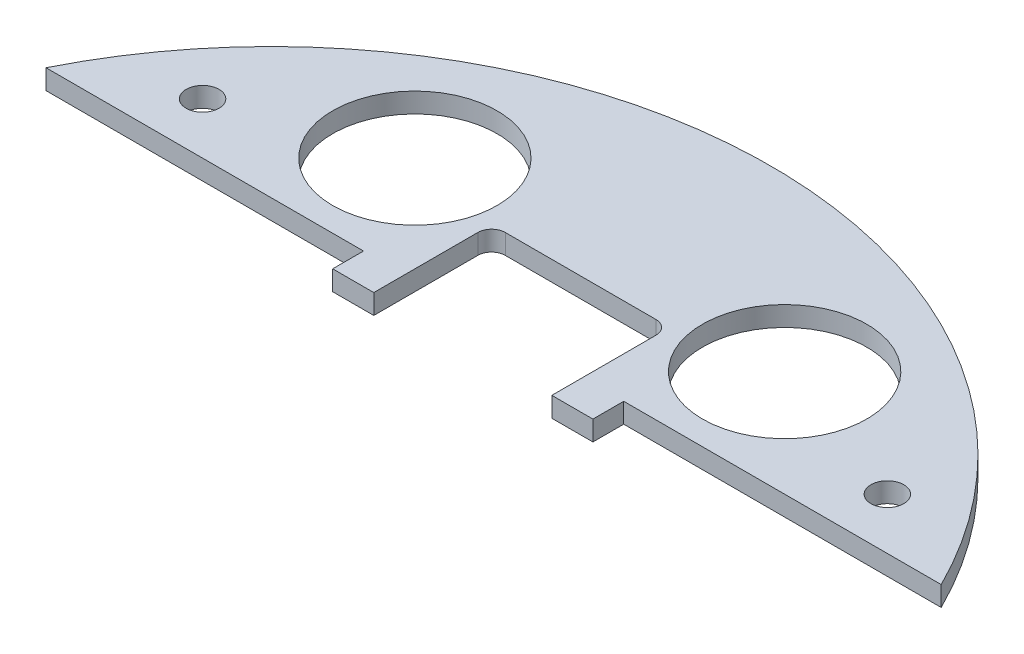
from build123d import *

# Parameters (mm, degrees)
BOSS_EXTRUDE1_DEPTH  = 2.9
SOLENOID_PLACEMENT_W = 38
SOLENOID_PLACEMENT_H = 64
CUT_EXTRUDE1_DEPTH   = 104.278313309
CUT_EXTRUDE4_DEPTH   = 104.278313309
SKETCH5_R            = 12
CUT_EXTRUDE5_DEPTH   = 104.278313309
SKETCH6_R            = 2.4
CUT_EXTRUDE6_DEPTH   = 104.278313309
SKETCH7_W            = 10
SKETCH7_H            = 62.80248699
CUT_EXTRUDE7_DEPTH   = 104.278313309
CUT_EXTRUDE3_DEPTH   = 104.278313309


with BuildPart() as part:
    # Sketch1 → Boss-Extrude1 (new body)
    with BuildSketch(Plane(origin=(0, 0, 0), x_dir=(1, 0, 0), z_dir=(0, 1, 0))):
        with BuildLine():
            ThreePointArc((36.856602833, -63.012624351), (0, 73), (-36.856602833, -63.012624351))
            ThreePointArc((-36.856602833, -63.012624351), (-33.368752207, -63.602994345), (-30.363140064, -61.737536127))
            ThreePointArc((-30.363140064, -61.737536127), (0, -46.75), (30.363140064, -61.737536127))
            ThreePointArc((30.363140064, -61.737536127), (33.368752207, -63.602994345), (36.856602833, -63.012624351))
        make_face()
    extrude(amount=BOSS_EXTRUDE1_DEPTH)

    # solenoid placement → Cut-Extrude1 (cut, through all)
    with BuildSketch(Plane(origin=(0, 2.9, 0), x_dir=(1, 0, 0), z_dir=(0, 1, 0))):
        with Locations((0, -4)):
            Rectangle(SOLENOID_PLACEMENT_W, SOLENOID_PLACEMENT_H)
    extrude(amount=-CUT_EXTRUDE1_DEPTH, mode=Mode.SUBTRACT)

    # Sketch4 → Cut-Extrude4 (cut, through all)
    with BuildSketch(Plane(origin=(0, 2.9, 0), x_dir=(1, 0, 0), z_dir=(0, 1, 0))):
        with BuildLine():
            Line((-13, 28), (13, 28))
            Line((13, 28), (13, 43.2))
            ThreePointArc((13, 43.2), (12.414213562, 44.614213562), (11, 45.2))
            Line((11, 45.2), (-11, 45.2))
            ThreePointArc((-11, 45.2), (-12.414213562, 44.614213562), (-13, 43.2))
            Line((-13, 43.2), (-13, 28))
        make_face()
    extrude(amount=-CUT_EXTRUDE4_DEPTH, mode=Mode.SUBTRACT)

    # Sketch5 → Cut-Extrude5 (cut, through all)
    with BuildSketch(Plane(origin=(0, 2.9, 0), x_dir=(1, 0, 0), z_dir=(0, 1, 0))):
        with Locations(Location((27, 48, 0), (0, 0, 270))):
            Circle(SKETCH5_R)
        with Locations(Location((-27, 48, 0), (0, 0, 270))):
            Circle(SKETCH5_R)
    extrude(amount=-CUT_EXTRUDE5_DEPTH, mode=Mode.SUBTRACT)

    # Sketch6 → Cut-Extrude6 (cut, through all)
    with BuildSketch(Plane(origin=(0, 2.9, 0), x_dir=(1, 0, 0), z_dir=(0, 1, 0))):
        with Locations(Location((40, -40, 0), (0, 0, 270))):
            Circle(SKETCH6_R)
        with Locations(Location((-40, -40, 0), (0, 0, 270))):
            Circle(SKETCH6_R)
        with Locations(Location((-50, 40, 0), (0, 0, 270))):
            Circle(SKETCH6_R)
        with Locations(Location((50, 40, 0), (0, 0, 270))):
            Circle(SKETCH6_R)
    extrude(amount=-CUT_EXTRUDE6_DEPTH, mode=Mode.SUBTRACT)

    # Sketch7 → Cut-Extrude7 (cut, through all)
    with BuildSketch(Plane(origin=(0, 2.9, 0), x_dir=(1, 0, 0), z_dir=(0, 1, 0))):
        with Locations((0, -31.401243495)):
            Rectangle(SKETCH7_W, SKETCH7_H)
    extrude(amount=-CUT_EXTRUDE7_DEPTH, mode=Mode.SUBTRACT)

    # Sketch3 → Cut-Extrude3 (cut, through all)
    with BuildSketch(Plane(origin=(0, 2.9, 0), x_dir=(1, 0, 0), z_dir=(0, 1, 0))):
        Polygon((-19, 28), (19, 28), (19, 32.5), (73, 32.5), (73, -32.5), (-73, -32.5), (-73, 32.5), (-19, 32.5), align=None)
    extrude(amount=-CUT_EXTRUDE3_DEPTH, mode=Mode.SUBTRACT)


with BuildPart() as cut_extrude3_piece_1:
    # of the separate pieces the step leaves, piece 1, a body of its own (cut_extrude3_pieces)
    add(part.part.solids().sort_by_distance((19, 0, -32.5))[0])


with BuildPart() as cut_extrude3_piece_2:
    # of the separate pieces the step leaves, piece 2, a body of its own (cut_extrude3_pieces)
    add(part.part.solids().sort_by_distance((30.363140064, 0, 61.737536127))[0])


with BuildPart() as cut_extrude3_piece_3:
    # of the separate pieces the step leaves, piece 3, a body of its own (cut_extrude3_pieces)
    add(part.part.solids().sort_by_distance((-36.856602833, 0, 63.012624351))[0])


solid = cut_extrude3_piece_1.part
